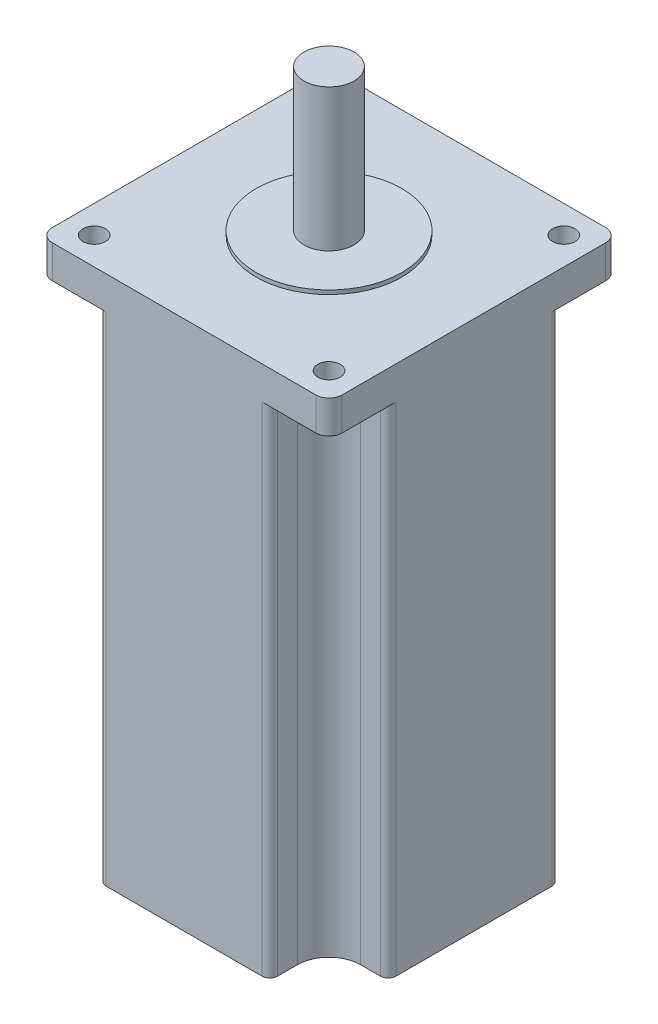
from build123d import *

# Parameters (mm, degrees)
SKETCH1_W           = 109.86
SKETCH1_H           = 109.86
SKETCH1_R           = 4.25
BOSS_EXTRUDE1_DEPTH = 201
FILLET1_R           = 5
SKETCH2_R           = 27.6
BOSS_EXTRUDE2_DEPTH = 1.52
SKETCH3_R           = 9.5
BOSS_EXTRUDE3_DEPTH = 55.37
CUT_EXTRUDE1_START  = -12.5
CUT_EXTRUDE1_DEPTH  = 205.37
FILLET2_R           = 3


with BuildPart() as part:
    # Sketch1 → Boss-Extrude1 (new body)
    with BuildSketch(Plane(origin=(0, 0, 0), x_dir=(1, 0, 0), z_dir=(0, 1, 0))):
        Rectangle(SKETCH1_W, SKETCH1_H)
        with Locations(Location((-44.5, 44.5, 0), (0, 0, 270))):
            Circle(SKETCH1_R, mode=Mode.SUBTRACT)
        with Locations(Location((44.5, 44.5, 0), (0, 0, 270))):
            Circle(SKETCH1_R, mode=Mode.SUBTRACT)
        with Locations(Location((44.5, -44.5, 0), (0, 0, 270))):
            Circle(SKETCH1_R, mode=Mode.SUBTRACT)
        with Locations(Location((-44.5, -44.5, 0), (0, 0, 270))):
            Circle(SKETCH1_R, mode=Mode.SUBTRACT)
    extrude(amount=-BOSS_EXTRUDE1_DEPTH)

    # Fillet1
    fillet1_edges = [part.edges().sort_by_distance(p)[0] for p in [
        (54.93, -100.5, 54.93),
        (-54.93, -100.5, 54.93),
        (-54.93, -100.5, -54.93),
        (54.93, -100.5, -54.93),
    ]]
    fillet(fillet1_edges, radius=FILLET1_R)

    # Sketch2 → Boss-Extrude2 (add)
    with BuildSketch(Plane(origin=(0, 0, 0), x_dir=(1, 0, 0), z_dir=(0, 1, 0))):
        with Locations(Location((0, 0, 0), (0, 0, 90))):
            Circle(SKETCH2_R)
    extrude(amount=BOSS_EXTRUDE2_DEPTH)

    # Sketch3 → Boss-Extrude3 (add)
    with BuildSketch(Plane(origin=(0, 0, 0), x_dir=(1, 0, 0), z_dir=(0, 1, 0))):
        with Locations(Location((0, 0, 0), (0, 0, 270))):
            Circle(SKETCH3_R)
    extrude(amount=BOSS_EXTRUDE3_DEPTH)

    # Sketch5 → Cut-Extrude1 (cut)
    with BuildSketch(Plane(origin=(0, 0, 0), x_dir=(1, 0, 0), z_dir=(0, 1, 0)).offset(CUT_EXTRUDE1_START)):
        with BuildLine():
            Line((-44.5, 32.5), (-57.57926657, 32.5))
            Line((-57.57926657, 32.5), (-57.57926657, 62.356452686))
            Line((-57.57926657, 62.356452686), (-32.5, 61.861560204))
            Line((-32.5, 61.861560204), (-32.5, 44.5))
            ThreePointArc((-32.5, 44.5), (-36.014718626, 36.014718626), (-44.5, 32.5))
        make_face()
        with BuildLine():
            Line((62.356452686, 57.57926657), (61.861560204, 32.5))
            Line((61.861560204, 32.5), (44.5, 32.5))
            ThreePointArc((44.5, 32.5), (36.014718626, 36.014718626), (32.5, 44.5))
            Line((32.5, 44.5), (32.5, 57.57926657))
            Line((32.5, 57.57926657), (62.356452686, 57.57926657))
        make_face()
        with BuildLine():
            Line((57.57926657, -62.356452686), (32.5, -61.861560204))
            Line((32.5, -61.861560204), (32.5, -44.5))
            ThreePointArc((32.5, -44.5), (36.014718626, -36.014718626), (44.5, -32.5))
            Line((44.5, -32.5), (57.57926657, -32.5))
            Line((57.57926657, -32.5), (57.57926657, -62.356452686))
        make_face()
        with BuildLine():
            Line((-62.356452686, -57.57926657), (-61.861560204, -32.5))
            Line((-61.861560204, -32.5), (-44.5, -32.5))
            ThreePointArc((-44.5, -32.5), (-36.014718626, -36.014718626), (-32.5, -44.5))
            Line((-32.5, -44.5), (-32.5, -57.57926657))
            Line((-32.5, -57.57926657), (-62.356452686, -57.57926657))
        make_face()
    extrude(amount=-CUT_EXTRUDE1_DEPTH, mode=Mode.SUBTRACT)

    # Fillet2
    fillet2_edges = [part.edges().sort_by_distance(p)[0] for p in [
        (32.5, -106.75, 54.93),
        (32.5, -106.75, -54.93),
        (54.93, -106.75, -32.5),
        (-54.93, -106.75, -32.5),
        (-32.5, -106.75, -54.93),
        (-32.5, -106.75, 54.93),
        (-54.93, -106.75, 32.5),
        (54.93, -106.75, 32.5),
    ]]
    fillet(fillet2_edges, radius=FILLET2_R)


solid = part.part
